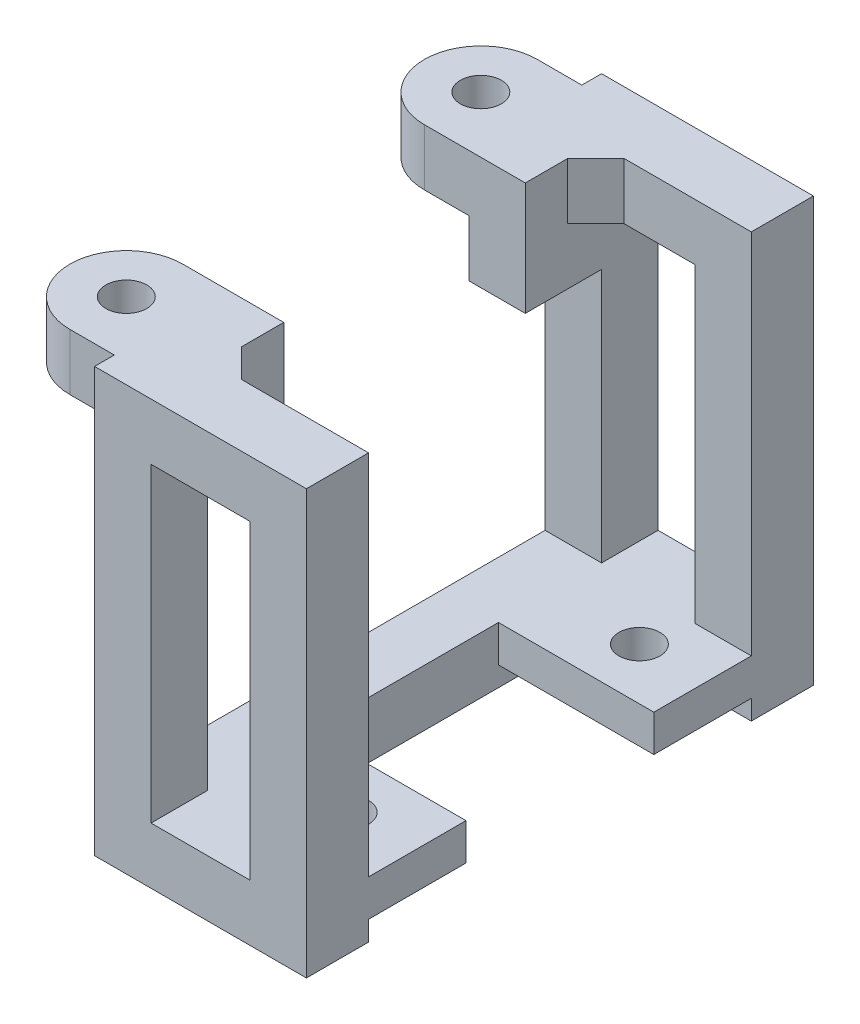
from build123d import *

# Parameters (mm, degrees)
BOSS_EXTRUDE1_DEPTH   = 38.1
BOSS_EXTRUDE1_2_DEPTH = 38.1
SKETCH2_W             = 7.62
SKETCH2_H             = 5.08
BOSS_EXTRUDE2_DEPTH   = 7.62
SKETCH3_R             = 1.8415
CUT_EXTRUDE1_DEPTH    = 60.428216724
FILLET1_R             = 2.54
FILLET2_R             = 2.54
SKETCH5_W             = 18.161
SKETCH5_H             = 5.08
SKETCH5_W_2           = 21.209
BOSS_EXTRUDE3_DEPTH   = 5.08
SKETCH6_W             = 8.89
SKETCH6_H             = 27.94
CUT_EXTRUDE2_DEPTH    = 63.393930338
SKETCH8_W             = 8.763
SKETCH8_H             = 3.302
BOSS_EXTRUDE4_DEPTH   = 13.97
SKETCH11_R            = 1.8415
CUT_EXTRUDE4_DEPTH    = 62.324385256
CUT_EXTRUDE5_START    = -5.08
SKETCH15_W            = 35.43046
SKETCH15_H            = 22.86
CUT_EXTRUDE5_DEPTH    = 5.08
SKETCH16_R            = 1.8415
BOSS_EXTRUDE5_DEPTH   = 5.08
SKETCH17_W            = 5.08
SKETCH17_H            = 21.717
CUT_EXTRUDE6_DEPTH    = 10.16
CHAMFER1_SIZE         = 2.54


with BuildPart() as part:
    # Sketch1 → Boss-Extrude1 (new body)
    with BuildSketch(Plane(origin=(0, 0, 0), x_dir=(1, 0, 0), z_dir=(0, 1, 0))):
        Polygon((0, 0), (0, 13.71346), (5.08, 13.71346), (5.08, 5.588), (19.05, 5.588), (19.05, 0), align=None)
    extrude(amount=BOSS_EXTRUDE1_DEPTH)

    # Sketch2 → Boss-Extrude2 (add)
    with BuildSketch(Plane.ZY):
        with Locations((-6.85546, 35.56)):
            Rectangle(SKETCH2_W, SKETCH2_H)
        with Locations((-38.73246, 35.56)):
            Rectangle(SKETCH2_W, SKETCH2_H)
    extrude(amount=BOSS_EXTRUDE2_DEPTH)


with BuildPart() as body_2:
    # Sketch1 → Boss-Extrude1 2 (new body)
    with BuildSketch(Plane(origin=(0, 0, 0), x_dir=(1, 0, 0), z_dir=(0, 1, 0))):
        Polygon((0, 31.87446), (5.08, 31.87446), (5.08, 40.00246), (19.05, 40.00246), (19.05, 45.59046), (0, 45.59046), align=None)
    extrude(amount=BOSS_EXTRUDE1_2_DEPTH)



with BuildPart() as boss_extrude2_piece_1:
    # of the separate pieces the step leaves, piece 1, a body of its own (boss_extrude2_pieces)
    add(part.part.solids().sort_by_distance((0, 0, 0))[0])


with BuildPart() as boss_extrude2_piece_2:
    # of the separate pieces the step leaves, piece 2, a body of its own (boss_extrude2_pieces)
    add(part.part.solids().sort_by_distance((0, 38.1, -34.92246))[0])


with BuildPart() as cut_extrude1_tool:
    # Sketch3 → Cut-Extrude1 (new, through all)
    with BuildSketch(Plane(origin=(0, 33.02, 0), x_dir=(-1, 0, 0), z_dir=(0, -1, 0))):
        with Locations(Location((3.996511692, 6.85546, 0), (0, 0, 90))):
            Circle(SKETCH3_R)
        with Locations(Location((3.996511692, 38.73246, 0), (0, 0, 90))):
            Circle(SKETCH3_R)
    extrude(amount=-CUT_EXTRUDE1_DEPTH)


with BuildPart() as boss_extrude2_piece_1_1:
    add(boss_extrude2_piece_1.part)

    # Cut-Extrude1: cut by cut_extrude1_tool
    add(cut_extrude1_tool.part, mode=Mode.SUBTRACT)

    # Fillet1
    fillet1_edges = [boss_extrude2_piece_1_1.edges().sort_by_distance(p)[0] for p in [
        (-7.62, 35.56, -10.66546),
        (-7.62, 35.56, -3.04546),
    ]]
    fillet(fillet1_edges, radius=FILLET1_R)


with BuildPart() as boss_extrude2_piece_2_1:
    add(boss_extrude2_piece_2.part)

    # Cut-Extrude1: cut by cut_extrude1_tool
    add(cut_extrude1_tool.part, mode=Mode.SUBTRACT)

    # Fillet2
    fillet2_edges = [boss_extrude2_piece_2_1.edges().sort_by_distance(p)[0] for p in [
        (-7.62, 35.56, -42.54246),
        (-7.62, 35.56, -34.92246),
    ]]
    fillet(fillet2_edges, radius=FILLET2_R)


with BuildPart() as body_2_1:
    add(body_2.part)

    add(boss_extrude2_piece_1_1.part)  # Boss-Extrude3 merges Boss-Extrude2 piece 1

    add(boss_extrude2_piece_2_1.part)  # Boss-Extrude3 merges Boss-Extrude2 piece 2
    # Sketch5 → Boss-Extrude3 (add)
    with BuildSketch(Plane.ZY):
        with Locations((-22.79396, 2.54)):
            Rectangle(SKETCH5_W, SKETCH5_H)
        with Locations((-24.31796, 30.48)):
            Rectangle(SKETCH5_W_2, SKETCH5_H)
    extrude(amount=-BOSS_EXTRUDE3_DEPTH)

    # Sketch6 → Cut-Extrude2 (cut, through all)
    with BuildSketch(Plane.XY):
        with Locations((9.525, 19.05)):
            Rectangle(SKETCH6_W, SKETCH6_H)
    extrude(amount=-CUT_EXTRUDE2_DEPTH, mode=Mode.SUBTRACT)

    # Sketch8 → Boss-Extrude4 (add)
    with BuildSketch(Plane(origin=(5.08, 0, 0), x_dir=(0, 0, -1), z_dir=(1, 0, 0))):
        with Locations((9.9695, 3.429)):
            Rectangle(SKETCH8_W, SKETCH8_H)
        with Locations((35.62096, 3.429)):
            Rectangle(SKETCH8_W, SKETCH8_H)
    extrude(amount=BOSS_EXTRUDE4_DEPTH)

    # Sketch11 → Cut-Extrude4 (cut, through all)
    with BuildSketch(Plane.XZ.offset(-1.778)):
        with Locations(Location((13.1064, -9.7028, 0), (0, 0, 270))):
            Circle(SKETCH11_R)
        with Locations(Location((13.1064, -35.88766, 0), (0, 0, 270))):
            Circle(SKETCH11_R)
    extrude(amount=-CUT_EXTRUDE4_DEPTH, mode=Mode.SUBTRACT)

    # Sketch15 → Cut-Extrude5 (cut)
    with BuildSketch(Plane.ZY.offset(CUT_EXTRUDE5_START)):
        with Locations((-22.79523, 16.51)):
            Rectangle(SKETCH15_W, SKETCH15_H)
    extrude(amount=CUT_EXTRUDE5_DEPTH, mode=Mode.SUBTRACT)

    # Sketch16 → Boss-Extrude5 (add)
    # profile 1 of 2: a face of its own
    with BuildSketch(Plane(origin=(0, 38.1, 0), x_dir=(1, 0, 0), z_dir=(0, 1, 0))):
        with BuildLine():
            Line((-3.996511692, 43.81246), (3.107709624, 43.81246))
            Line((3.107709624, 43.81246), (3.042520574, 33.65246))
            Line((3.042520574, 33.65246), (-3.996511692, 33.65246))
            ThreePointArc((-3.996511692, 33.65246), (-9.076511692, 38.73246), (-3.996511692, 43.81246))
        make_face()
        with Locations(Location((-3.996511692, 38.73246, 0), (0, 0, 90))):
            Circle(SKETCH16_R, mode=Mode.SUBTRACT)
    # profile 2 of 2: a face of its own
    with BuildSketch(Plane(origin=(0, 38.1, 0), x_dir=(1, 0, 0), z_dir=(0, 1, 0))):
        with BuildLine():
            Line((-3.996511692, 11.93546), (2.83798993, 11.93546))
            ThreePointArc((2.83798993, 11.93546), (2.870583784, 11.935355436), (2.903176296, 11.935041748))
            Line((2.903176296, 11.935041748), (2.83798993, 1.77546))
            Line((2.83798993, 1.77546), (-3.996511692, 1.77546))
            ThreePointArc((-3.996511692, 1.77546), (-9.076511692, 6.85546), (-3.996511692, 11.93546))
        make_face()
        with Locations(Location((-3.996511692, 6.85546, 0), (0, 0, 90))):
            Circle(SKETCH16_R, mode=Mode.SUBTRACT)
    extrude(amount=-BOSS_EXTRUDE5_DEPTH)

    # Sketch17 → Cut-Extrude6 (cut)
    with BuildSketch(Plane(origin=(0, 38.1, 0), x_dir=(1, 0, 0), z_dir=(0, 1, 0))):
        with Locations((2.54, 22.79396)):
            Rectangle(SKETCH17_W, SKETCH17_H)
    extrude(amount=-CUT_EXTRUDE6_DEPTH, mode=Mode.SUBTRACT)

    # Chamfer1
    chamfer1_edges = [body_2_1.edges().sort_by_distance(p)[0] for p in [
        (5.08, 35.56, -40.00246),
        (5.08, 35.56, -5.588),
    ]]
    chamfer(chamfer1_edges, length=CHAMFER1_SIZE)


solid = body_2_1.part
